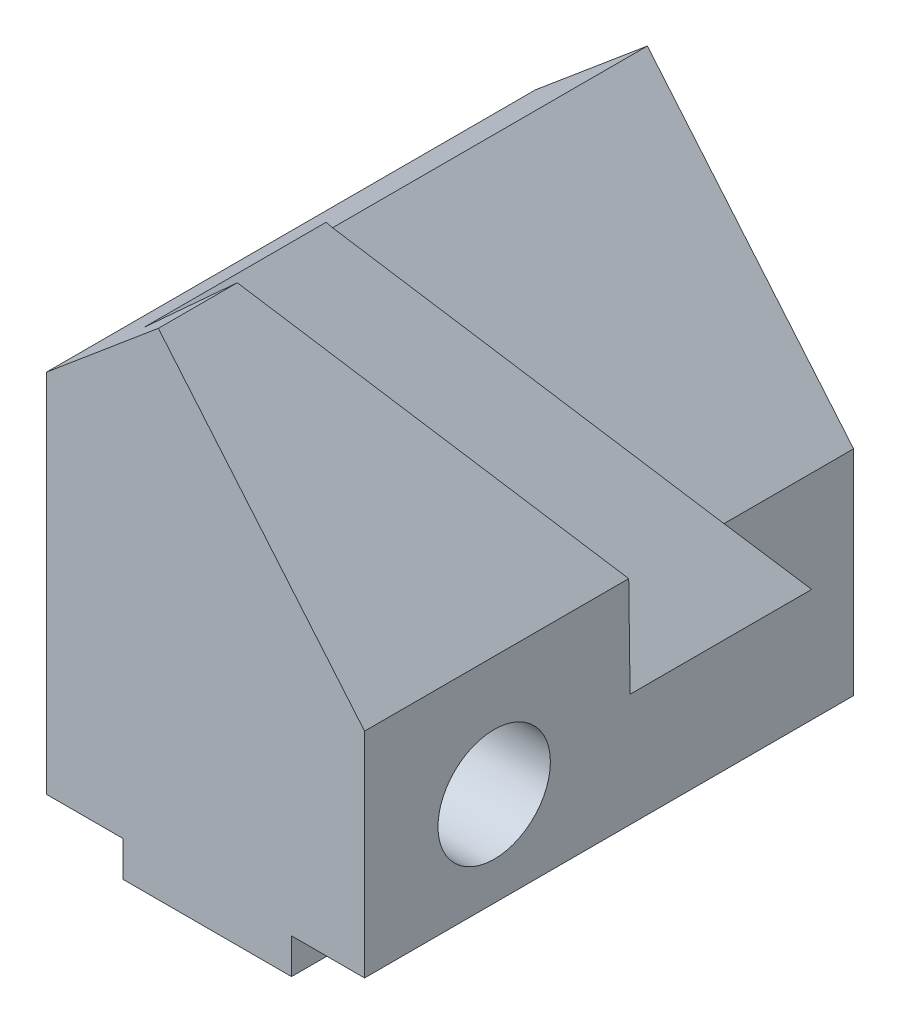
from build123d import *

# Parameters (mm, degrees)
FRONT_PLANE_EXTRUDED_BOSS_DEPTH       = 83
SMALLER_TRIANGULAR_EXTRUDED_CUT_DEPTH = 122.136286884
BIGGER_TRIANGULAR_EXTRUDED_CUT_DEPTH  = 122.136286884
F_19_075D_HOLE_D                      = 19.07499995
DOVETAIL_EXTRUDED_CUT_DEPTH           = 106.52963508
DOVETAIL_EXTRUDED_CUT_DEPTH_BACK      = 106.52963508


with BuildPart() as part:
    # Sketch4 → Front Plane Extruded Boss (new body)
    with BuildSketch(Plane.XY):
        Polygon((14.6, 0), (-14, 0), (-14, 6), (-27, 6), (-27, 84), (27, 84), (27, 6), (14.6, 6), align=None)
    extrude(amount=FRONT_PLANE_EXTRUDED_BOSS_DEPTH)

    # Sketch5 → Smaller Triangular Extruded Cut (cut, through all)
    with BuildSketch(Plane.XY.offset(83)):
        Polygon((-27, 84), (-8, 84), (-27, 68.057107008), align=None)
    extrude(amount=-SMALLER_TRIANGULAR_EXTRUDED_CUT_DEPTH, mode=Mode.SUBTRACT)

    # Sketch6 → Bigger Triangular Extruded Cut (cut, through all)
    with BuildSketch(Plane.XY.offset(83)):
        Polygon((27, 84), (-8, 84), (27, 42.288624259), align=None)
    extrude(amount=-BIGGER_TRIANGULAR_EXTRUDED_CUT_DEPTH, mode=Mode.SUBTRACT)

    # 19.075D Hole (through all)
    with Locations(Plane(origin=(27, 0, 0), x_dir=(0, 0, -1), z_dir=(1, 0, 0))):
        with Locations((-61, 22)):
            Hole(F_19_075D_HOLE_D / 2)

    # Sketch13 → Dovetail Extruded Cut (cut, two sides: drawn at the far end of the back side and taken through both)
    with BuildSketch(Plane(origin=(-8, 84, 53.436914958), x_dir=(0.8307334510088613, 0.4445504234012626, 0.3350475405500927), z_dir=(-0.5566703992264255, 0.6634139481689373, 0.49999999999999484)).offset(-DOVETAIL_EXTRUDED_CUT_DEPTH_BACK)):
        Polygon((0, 0), (-12.600448024, 1.600638285), (-2.270103373, -23.021812416), (5.416314056, -12.909823471), align=None)
    extrude(amount=DOVETAIL_EXTRUDED_CUT_DEPTH + DOVETAIL_EXTRUDED_CUT_DEPTH_BACK, mode=Mode.SUBTRACT)


solid = part.part
